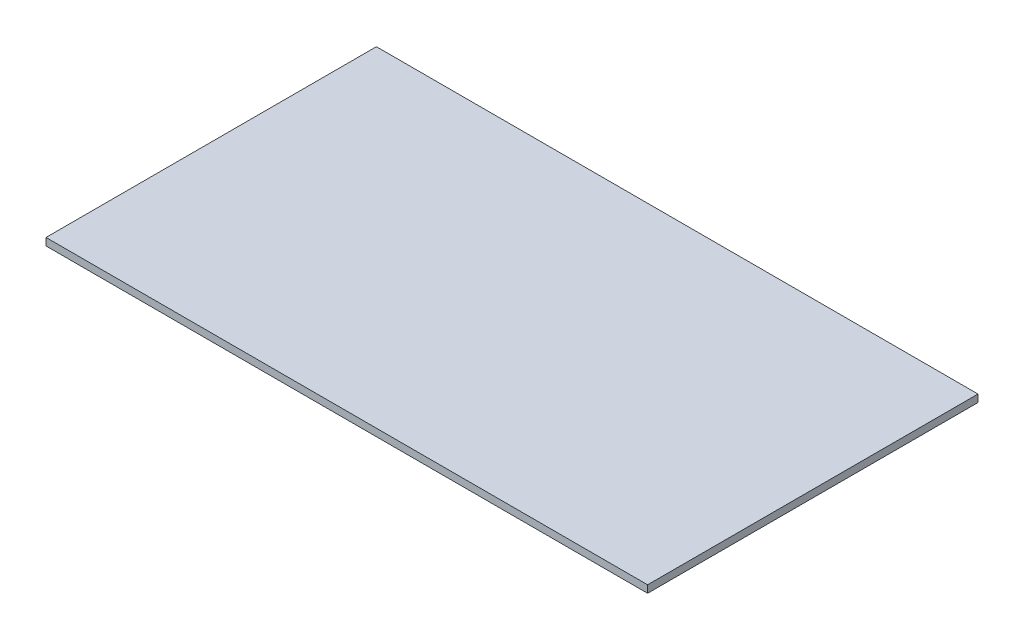
from build123d import *

# Parameters (mm, degrees)
SKETCH1_W           = 244
SKETCH1_H           = 134
BOSS_EXTRUDE1_DEPTH = 3


with BuildPart() as part:
    # Sketch1 → Boss-Extrude1 (new body)
    with BuildSketch(Plane(origin=(0, 0, 0), x_dir=(1, 0, 0), z_dir=(0, 1, 0))):
        Rectangle(SKETCH1_W, SKETCH1_H)
    extrude(amount=BOSS_EXTRUDE1_DEPTH)


solid = part.part
